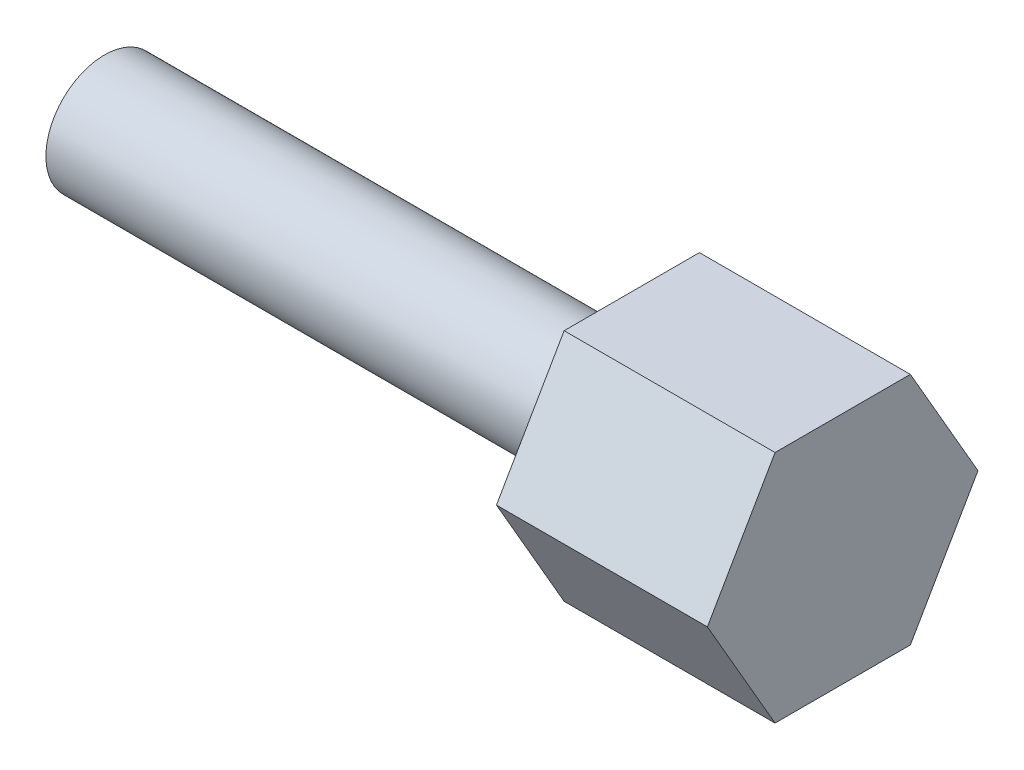
from build123d import *

# Parameters (mm, degrees)
SKETCH1_R           = 3.175
BOSS_EXTRUDE1_DEPTH = 11.43
SKETCH1_3_R         = 3.175
BOSS_EXTRUDE2_DEPTH = 28.575


with BuildPart() as part:
    # Sketch1 → Boss-Extrude1 (new body)
    # profile 1 of 2: a face of its own
    with BuildSketch(Plane(origin=(0, 0, 0), x_dir=(0, 0, -1), z_dir=(1, 0, 0))):
        Polygon((3.666174209, -6.35), (7.332348419, 0), (3.666174209, 6.35), (-3.666174209, 6.35), (-7.332348419, 0), (-3.666174209, -6.35), align=None)
        Circle(SKETCH1_R, mode=Mode.SUBTRACT)
    # profile 2 of 2: a face of its own
    with BuildSketch(Plane(origin=(0, 0, 0), x_dir=(0, 0, -1), z_dir=(1, 0, 0))):
        Circle(SKETCH1_R)
    extrude(amount=BOSS_EXTRUDE1_DEPTH)

    # Sketch1<3> → Boss-Extrude2 (add)
    with BuildSketch(Plane(origin=(0, 0, 0), x_dir=(0, 0, -1), z_dir=(1, 0, 0))):
        Circle(SKETCH1_3_R)
    extrude(amount=-BOSS_EXTRUDE2_DEPTH)


solid = part.part
